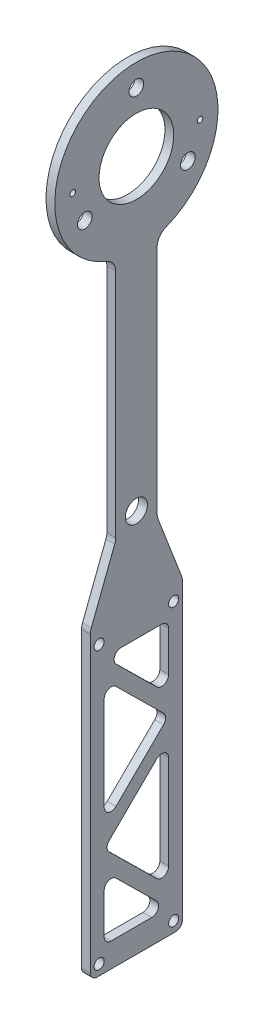
from build123d import *

# Parameters (mm, degrees)
SKETCH1_R                = 2.65
SKETCH1_R_2              = 4
SKETCH1_R_3              = 1.8288
SKETCH1_W                = 41.514809608
SKETCH1_H                = 98.81
BOSS_EXTRUDE1_DEPTH      = 3.175
CUT_EXTRUDE1_REACH       = 179.99
SKETCH2_W                = 4.112404804
SKETCH2_H                = 133.245584328
FILLET3_R                = 2.5
FILLET4_R                = 5
M2_5X0_45_TAPPED_HOLE1_D = 2.05


with BuildPart() as part:
    # Sketch1 → Boss-Extrude1 (new body)
    # profile 1 of 8: a face of its own
    with BuildSketch(Plane(origin=(0, 0, 0), x_dir=(0, 0, -1), z_dir=(1, 0, 0))):
        with BuildLine():
            Line((7.5, 134.77502784), (7.5, 117.469314765))
            ThreePointArc((7.5, 117.469314765), (23.361292772, 127.986116465), (29.5, 146))
            ThreePointArc((29.5, 146), (-18.013883535, 169.361292772), (-7.5, 117.469314765))
            Line((-7.5, 117.469314765), (-7.5, 134.77502784))
            ThreePointArc((-7.5, 134.77502784), (-6.363961031, 157.9058809), (13.5, 146))
            ThreePointArc((13.5, 146), (11.9058809, 139.636038969), (7.5, 134.77502784))
        make_face()
        with Locations((-18.619546181, 135.25)):
            Circle(SKETCH1_R, mode=Mode.SUBTRACT)
        with Locations((0, 167.5)):
            Circle(SKETCH1_R, mode=Mode.SUBTRACT)
        with Locations((18.619546181, 135.25)):
            Circle(SKETCH1_R, mode=Mode.SUBTRACT)
    # profile 2 of 8: a face of its own
    with BuildSketch(Plane(origin=(0, 0, 0), x_dir=(0, 0, -1), z_dir=(1, 0, 0))):
        with BuildLine():
            ThreePointArc((-7.5, 117.469314765), (0, 116.5), (7.5, 117.469314765))
            Line((7.5, 117.469314765), (7.5, 134.77502784))
            ThreePointArc((7.5, 134.77502784), (0, 132.5), (-7.5, 134.77502784))
            Line((-7.5, 134.77502784), (-7.5, 117.469314765))
        make_face()
    # profile 3 of 8: a face of its own
    with BuildSketch(Plane(origin=(0, 0, 0), x_dir=(0, 0, -1), z_dir=(1, 0, 0))):
        with BuildLine():
            Line((0, 48.916537522), (6.674602804, 31.57952088))
            ThreePointArc((6.674602804, 31.57952088), (7.290731137, 33.240670729), (7.5, 35))
            Line((7.5, 35), (7.5, 117.469314765))
            ThreePointArc((7.5, 117.469314765), (0, 116.5), (-7.5, 117.469314765))
            Line((-7.5, 117.469314765), (-7.5, 35))
            ThreePointArc((-7.5, 35), (-7.290731137, 33.240670729), (-6.674602804, 31.57952088))
            Line((-6.674602804, 31.57952088), (0, 48.916537522))
        make_face()
    # profile 4 of 8: a face of its own
    with BuildSketch(Plane(origin=(0, 0, 0), x_dir=(0, 0, -1), z_dir=(1, 0, 0))):
        with BuildLine():
            ThreePointArc((-6.674602804, 31.57952088), (0, 27.5), (6.674602804, 31.57952088))
            Line((6.674602804, 31.57952088), (0, 48.916537522))
            Line((0, 48.916537522), (-6.674602804, 31.57952088))
        make_face()
        with Locations((0, 35)):
            Circle(SKETCH1_R_2, mode=Mode.SUBTRACT)
    # profile 5 of 8: a face of its own
    with BuildSketch(Plane(origin=(0, 0, 0), x_dir=(0, 0, -1), z_dir=(1, 0, 0))):
        with BuildLine():
            Line((-20.757404804, -5), (20.757404804, -5))
            Line((20.757404804, -5), (7.5, 29.435584328))
            Line((7.5, 29.435584328), (6.674602804, 31.57952088))
            ThreePointArc((6.674602804, 31.57952088), (0, 27.5), (-6.674602804, 31.57952088))
            Line((-6.674602804, 31.57952088), (-7.5, 29.435584328))
            Line((-7.5, 29.435584328), (-20.757404804, -5))
        make_face()
        with Locations((-13.4747, 0)):
            Circle(SKETCH1_R_3, mode=Mode.SUBTRACT)
        with Locations((13.4747, 0)):
            Circle(SKETCH1_R_3, mode=Mode.SUBTRACT)
    # profile 6 of 8: a face of its own
    with BuildSketch(Plane(origin=(0, 0, 0), x_dir=(0, 0, -1), z_dir=(1, 0, 0))):
        with BuildLine():
            Line((-7.5, 35), (-7.5, 29.435584328))
            Line((-7.5, 29.435584328), (-6.674602804, 31.57952088))
            ThreePointArc((-6.674602804, 31.57952088), (-7.290731137, 33.240670729), (-7.5, 35))
        make_face()
    # profile 7 of 8: a face of its own
    with BuildSketch(Plane(origin=(0, 0, 0), x_dir=(0, 0, -1), z_dir=(1, 0, 0))):
        with BuildLine():
            Line((6.674602804, 31.57952088), (7.5, 29.435584328))
            Line((7.5, 29.435584328), (7.5, 35))
            ThreePointArc((7.5, 35), (7.290731137, 33.240670729), (6.674602804, 31.57952088))
        make_face()
    # profile 8 of 8: a face of its own
    with BuildSketch(Plane(origin=(0, 0, 0), x_dir=(0, 0, -1), z_dir=(1, 0, 0))):
        with Locations((0, -54.405)):
            Rectangle(SKETCH1_W, SKETCH1_H)
        with Locations((13.4747, -100)):
            Circle(SKETCH1_R_3, mode=Mode.SUBTRACT)
        with Locations((-13.4747, -100)):
            Circle(SKETCH1_R_3, mode=Mode.SUBTRACT)
    extrude(amount=BOSS_EXTRUDE1_DEPTH)

    # Sketch2 → Cut-Extrude1 (cut, up to next)
    with BuildSketch(Plane(origin=(3.175, 0, 0), x_dir=(0, 0, -1), z_dir=(1, 0, 0)), mode=Mode.PRIVATE) as cut_extrude1_sk1:
        Polygon((11.645, -5), (-11.645, -5), (11.645, -27.976379872), align=None)
    cut_extrude1_tool1 = extrude(cut_extrude1_sk1.sketch, amount=-CUT_EXTRUDE1_REACH, mode=Mode.PRIVATE) & part.part
    # Sketch2 → Cut-Extrude1 (cut, up to next)
    with BuildSketch(Plane(origin=(3.175, 0, 0), x_dir=(0, 0, -1), z_dir=(1, 0, 0)), mode=Mode.PRIVATE) as cut_extrude1_sk2:
        Polygon((-11.645, -12.023620128), (11.645, -35), (-11.645, -57.976379872), (-11.645, -35), align=None)
    cut_extrude1_tool2 = extrude(cut_extrude1_sk2.sketch, amount=-CUT_EXTRUDE1_REACH, mode=Mode.PRIVATE) & part.part
    # Sketch2 → Cut-Extrude1 (cut, up to next)
    with BuildSketch(Plane(origin=(3.175, 0, 0), x_dir=(0, 0, -1), z_dir=(1, 0, 0)), mode=Mode.PRIVATE) as cut_extrude1_sk3:
        Polygon((-11.645, -72.023620128), (-11.645, -95), (11.645, -95), align=None)
    cut_extrude1_tool3 = extrude(cut_extrude1_sk3.sketch, amount=-CUT_EXTRUDE1_REACH, mode=Mode.PRIVATE) & part.part
    # Sketch2 → Cut-Extrude1 (cut, up to next)
    with BuildSketch(Plane(origin=(3.175, 0, 0), x_dir=(0, 0, -1), z_dir=(1, 0, 0)), mode=Mode.PRIVATE) as cut_extrude1_sk4:
        Polygon((11.645, -42.023620128), (11.645, -65), (11.645, -87.976379872), (-11.645, -65), align=None)
    cut_extrude1_tool4 = extrude(cut_extrude1_sk4.sketch, amount=-CUT_EXTRUDE1_REACH, mode=Mode.PRIVATE) & part.part
    # Sketch2 → Cut-Extrude1 (cut, up to next)
    with BuildSketch(Plane(origin=(3.175, 0, 0), x_dir=(0, 0, -1), z_dir=(1, 0, 0)), mode=Mode.PRIVATE) as cut_extrude1_sk5:
        with Locations((-18.701202402, -37.187207836)):
            Rectangle(SKETCH2_W, SKETCH2_H)
    cut_extrude1_tool5 = extrude(cut_extrude1_sk5.sketch, amount=-CUT_EXTRUDE1_REACH, mode=Mode.PRIVATE) & part.part
    # Sketch2 → Cut-Extrude1 (cut, up to next)
    with BuildSketch(Plane(origin=(3.175, 0, 0), x_dir=(0, 0, -1), z_dir=(1, 0, 0)), mode=Mode.PRIVATE) as cut_extrude1_sk6:
        with Locations((18.701202402, -37.187207836)):
            Rectangle(SKETCH2_W, SKETCH2_H)
    cut_extrude1_tool6 = extrude(cut_extrude1_sk6.sketch, amount=-CUT_EXTRUDE1_REACH, mode=Mode.PRIVATE) & part.part
    add(cut_extrude1_tool1.solids().sort_by_distance((3.175, -12.658793, -3.881667))[0], mode=Mode.SUBTRACT)
    add(cut_extrude1_tool2.solids().sort_by_distance((3.175, -35, 3.881667))[0], mode=Mode.SUBTRACT)
    add(cut_extrude1_tool3.solids().sort_by_distance((3.175, -87.341207, 3.881667))[0], mode=Mode.SUBTRACT)
    add(cut_extrude1_tool4.solids().sort_by_distance((3.175, -65, -3.881667))[0], mode=Mode.SUBTRACT)
    add(cut_extrude1_tool5.solids().sort_by_distance((3.175, -37.187208, 18.701202))[0], mode=Mode.SUBTRACT)
    add(cut_extrude1_tool6.solids().sort_by_distance((3.175, -37.187208, -18.701202))[0], mode=Mode.SUBTRACT)

    # Fillet3
    fillet3_edges = [part.edges().sort_by_distance(p)[0] for p in [
        (1.5875, -72.023620128, 11.645),
        (1.5875, -95, -11.645),
        (1.5875, -95, 11.645),
        (1.5875, -87.976379872, -11.645),
        (1.5875, -65, 11.645),
        (1.5875, -42.023620128, -11.645),
        (1.5875, -27.976379872, -11.645),
        (1.5875, -5, 11.645),
        (1.5875, -5, -11.645),
        (1.5875, -103.81, 16.645),
        (1.5875, -12.023620128, 11.645),
        (1.5875, -35, -11.645),
        (1.5875, -57.976379872, 11.645),
        (1.5875, -103.81, -16.645),
    ]]
    fillet(fillet3_edges, radius=FILLET3_R)

    # Fillet4
    fillet4_edges = [part.edges().sort_by_distance(p)[0] for p in [
        (1.5875, 117.469314765, -7.5),
        (1.5875, 29.435584328, -7.5),
        (1.5875, 29.435584328, 7.5),
        (1.5875, 117.469314765, 7.5),
        (1.5875, 5.681808734, 16.645),
        (1.5875, 5.681808734, -16.645),
    ]]
    fillet(fillet4_edges, radius=FILLET4_R)

    # M2.5x0.45 Tapped Hole1 (through all)
    with Locations(Plane(origin=(3.175, 0, 0), x_dir=(0, 0, -1), z_dir=(1, 0, 0))):
        with Locations((23.015, 146), (-23.015, 146)):
            Hole(M2_5X0_45_TAPPED_HOLE1_D / 2)


solid = part.part
